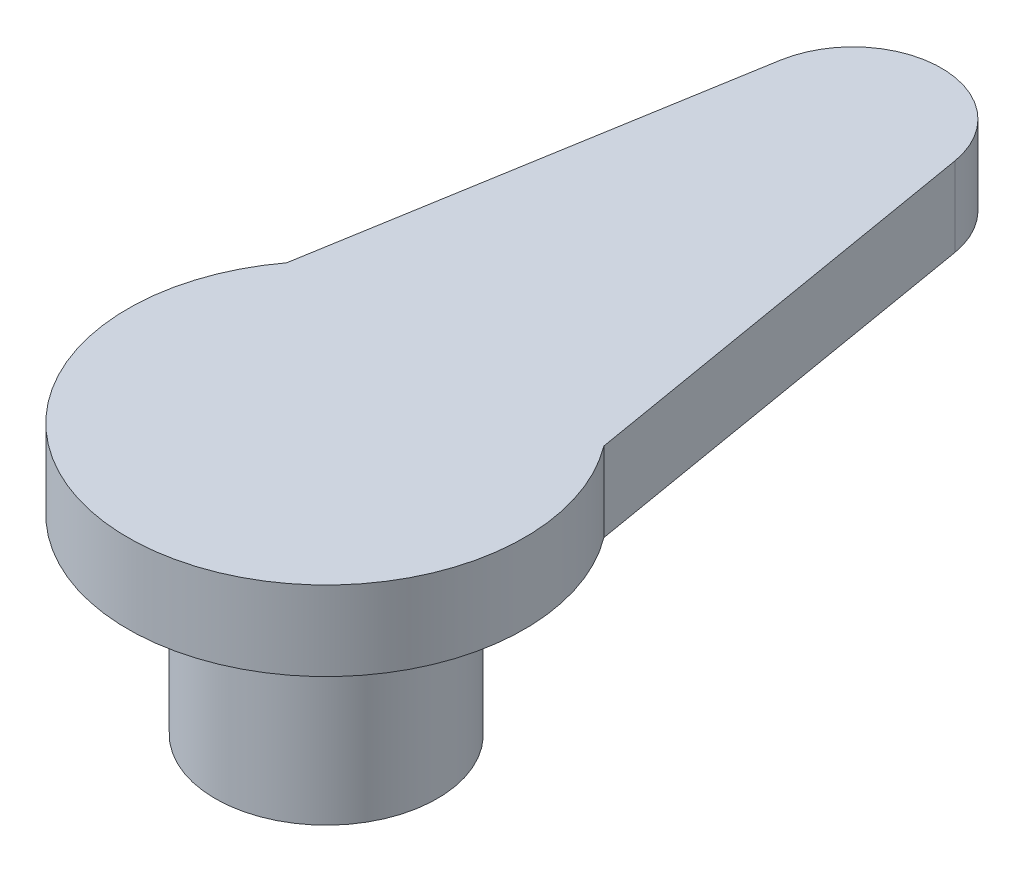
from build123d import *

# Parameters (mm, degrees)
SKETCH1_R           = 6.25
BOSS_EXTRUDE1_DEPTH = 2.5
SKETCH2_R           = 3.5
BOSS_EXTRUDE2_DEPTH = 6
CUT_EXTRUDE1_DEPTH  = 6


with BuildPart() as part:
    # Sketch1 → Boss-Extrude1 (new body)
    with BuildSketch(Plane(origin=(0, 0, 0), x_dir=(1, 0, 0), z_dir=(0, 1, 0))):
        with BuildLine():
            ThreePointArc((-5, 3.75), (0, 6.25), (5, 3.75))
            Line((5, 3.75), (2.75, 17.061179512))
            ThreePointArc((2.75, 17.061179512), (0, 19.385353712), (-2.75, 17.061179512))
            Line((-2.75, 17.061179512), (-5, 3.75))
        make_face()
        Circle(SKETCH1_R)
    extrude(amount=BOSS_EXTRUDE1_DEPTH)

    # Sketch2 → Boss-Extrude2 (add)
    with BuildSketch(Plane.XZ):
        with Locations(Location((0, 0, 0), (0, 0, 90))):
            Circle(SKETCH2_R)
    extrude(amount=BOSS_EXTRUDE2_DEPTH)

    # Sketch3 → Cut-Extrude1 (cut)
    with BuildSketch(Plane.XZ.offset(6)):
        with BuildLine():
            Line((-1.459451952, -1.475), (1.459451952, -1.475))
            ThreePointArc((1.459451952, -1.475), (1.91493966, -0.799143979), (2.075, 0))
            ThreePointArc((2.075, 0), (-0.799143979, 1.91493966), (-1.459451952, -1.475))
        make_face()
    extrude(amount=-CUT_EXTRUDE1_DEPTH, mode=Mode.SUBTRACT)


solid = part.part
